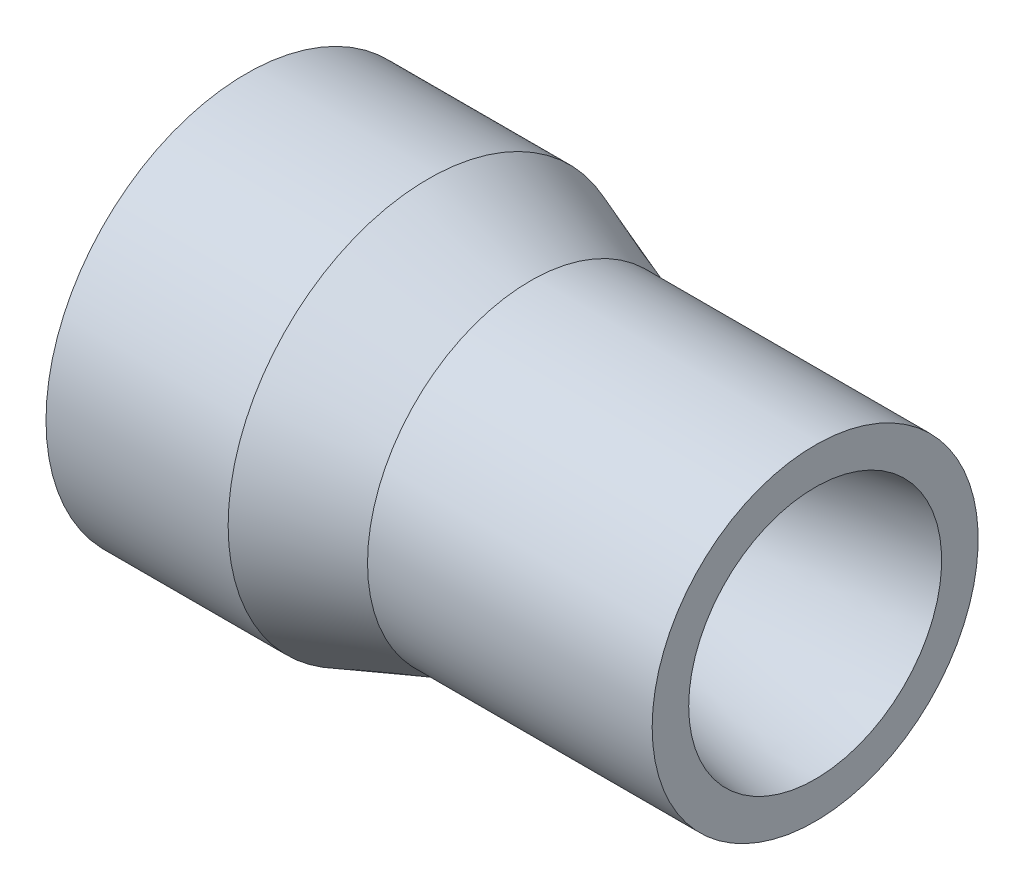
from build123d import *


with BuildPart() as part:
    # Sketch1 → Revolve1 (revolve)
    with BuildSketch(Plane.XY, mode=Mode.PRIVATE) as revolve1_sk:
        with BuildLine():
            Line((40.009783738, 31.438579704), (62.67, 18.355697745))
            ThreePointArc((62.67, 18.355697745), (68.197867486, 16.065980061), (74.13, 15.285))
            ThreePointArc((74.13, 15.285), (75.100914352, 15.366273985), (76.044804705, 15.607833794))
            add(Edge.make_bspline(
                [(76.044804705, 15.607833794), (97.235237256, 22.962250615), (126.012294015, 29.837045564), (148.34, 32.975)],
                knots=[0, 0, 0, 0, 1, 1, 1, 1], degree=3))
            Line((148.34, 32.975), (148.34, 42.5))
            Line((148.34, 42.5), (74.13, 42.5))
            Line((74.13, 42.5), (47.487711464, 52.197))
            Line((47.487711464, 52.197), (0, 52.197))
            Line((0, 52.197), (0, 42.8625))
            ThreePointArc((0, 42.8625), (20.709494319, 39.618255919), (40.009783738, 31.438579704))
        make_face()
    revolve(revolve1_sk.sketch.rotate(Axis((0, 0, 0), (1, 0, 0)), 90), axis=Axis((0, 0, 0), (1, 0, 0)))


solid = part.part
